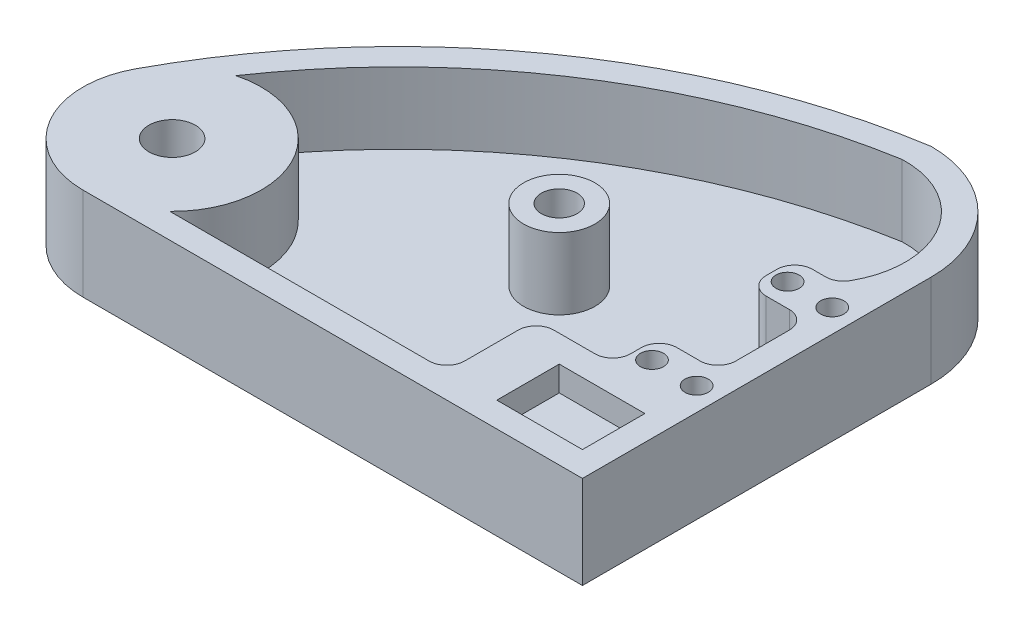
from build123d import *

# Parameters (mm, degrees)
SKETCH1_W           = 24
SKETCH1_H           = 17.5
SKETCH1_R           = 3.249999996
SKETCH1_R_2         = 3.25
SKETCH1_R_3         = 6.5
BOSS_EXTRUDE1_DEPTH = 26
SKETCH1_3_R         = 10
BOSS_EXTRUDE2_DEPTH = 6
SKETCH1_4_W         = 24
SKETCH1_4_H         = 17.5
BOSS_EXTRUDE3_DEPTH = 19
SKETCH1_5_R         = 10
SKETCH1_5_R_2       = 5
BOSS_EXTRUDE4_DEPTH = 26


with BuildPart() as part:
    # Sketch1 → Boss-Extrude1 (new body)
    with BuildSketch(Plane(origin=(0, 0, 0), x_dir=(1, 0, 0), z_dir=(0, 1, 0))):
        with BuildLine():
            ThreePointArc((38.25, 65.967283386), (-37.738740481, 34.900395081), (-92.028760258, -26.679098109))
            ThreePointArc((-92.028760258, -26.679098109), (-91.453700698, -51.335058487), (-70, -63.5))
            Line((-70, -63.5), (70, -63.5))
            Line((70, -63.5), (70, 34.217283386))
            ThreePointArc((70, 34.217283386), (60.700640303, 56.667923689), (38.25, 65.967283386))
        make_face()
        with BuildLine():
            Line((20, -56.5), (-52.650648427, -56.5))
            ThreePointArc((-52.650648427, -56.5), (-48.204829606, -26.253753738), (-76.350661821, -14.320068353))
            ThreePointArc((-76.350661821, -14.320068353), (-26.940104532, 33.755265523), (37.320914143, 58.718486024))
            ThreePointArc((37.320914143, 58.718486024), (59.232009713, 46.90299975), (59.514375282, 22.010790233))
            ThreePointArc((59.514375282, 22.010790233), (57.683425726, 20.172988974), (55.178036419, 19.5))
            Line((55.178036419, 19.5), (51.5, 19.5))
            ThreePointArc((51.5, 19.5), (47.964466094, 18.035533906), (46.5, 14.5))
            Line((46.5, 14.5), (46.5, 11.5))
            ThreePointArc((46.5, 11.5), (47.964466094, 7.964466094), (51.5, 6.5))
            Line((51.5, 6.5), (58, 6.5))
            ThreePointArc((58, 6.5), (61.535533906, 5.035533906), (63, 1.5))
            Line((63, 1.5), (63, -13.5))
            ThreePointArc((63, -13.5), (61.535533906, -17.035533906), (58, -18.5))
            Line((58, -18.5), (51.5, -18.5))
            ThreePointArc((51.5, -18.5), (47.964466094, -19.964466094), (46.5, -23.5))
            Line((46.5, -23.5), (46.5, -26.5))
            ThreePointArc((46.5, -26.5), (45.035533906, -30.035533906), (41.5, -31.5))
            Line((41.5, -31.5), (30, -31.5))
            ThreePointArc((30, -31.5), (26.464466094, -32.964466094), (25, -36.5))
            Line((25, -36.5), (25, -51.5))
            ThreePointArc((25, -51.5), (23.535533906, -55.035533906), (20, -56.5))
        make_face(mode=Mode.SUBTRACT)
        with Locations((51, -47.75)):
            Rectangle(SKETCH1_W, SKETCH1_H, mode=Mode.SUBTRACT)
        with Locations((51, -25)):
            Circle(SKETCH1_R, mode=Mode.SUBTRACT)
        with Locations((63.5, -25)):
            Circle(SKETCH1_R_2, mode=Mode.SUBTRACT)
        with Locations((51, 13)):
            Circle(SKETCH1_R, mode=Mode.SUBTRACT)
        with Locations((63.5, 13)):
            Circle(SKETCH1_R_2, mode=Mode.SUBTRACT)
        with Locations((-70, -38.5)):
            Circle(SKETCH1_R_3, mode=Mode.SUBTRACT)
    extrude(amount=BOSS_EXTRUDE1_DEPTH)

    # Sketch1<3> → Boss-Extrude2 (add)
    with BuildSketch(Plane(origin=(0, 0, 0), x_dir=(1, 0, 0), z_dir=(0, 1, 0))):
        with BuildLine():
            ThreePointArc((-45, -38.5), (-46.992025412, -48.279218033), (-52.650648427, -56.5))
            Line((-52.650648427, -56.5), (20, -56.5))
            ThreePointArc((20, -56.5), (23.535533906, -55.035533906), (25, -51.5))
            Line((25, -51.5), (25, -36.5))
            ThreePointArc((25, -36.5), (26.464466094, -32.964466094), (30, -31.5))
            Line((30, -31.5), (41.5, -31.5))
            ThreePointArc((41.5, -31.5), (45.035533906, -30.035533906), (46.5, -26.5))
            Line((46.5, -26.5), (46.5, -23.5))
            ThreePointArc((46.5, -23.5), (47.964466094, -19.964466094), (51.5, -18.5))
            Line((51.5, -18.5), (58, -18.5))
            ThreePointArc((58, -18.5), (61.535533906, -17.035533906), (63, -13.5))
            Line((63, -13.5), (63, 1.5))
            ThreePointArc((63, 1.5), (61.535533906, 5.035533906), (58, 6.5))
            Line((58, 6.5), (51.5, 6.5))
            ThreePointArc((51.5, 6.5), (47.964466094, 7.964466094), (46.5, 11.5))
            Line((46.5, 11.5), (46.5, 14.5))
            ThreePointArc((46.5, 14.5), (47.964466094, 18.035533906), (51.5, 19.5))
            Line((51.5, 19.5), (55.178036419, 19.5))
            ThreePointArc((55.178036419, 19.5), (57.683425726, 20.172988974), (59.514375282, 22.010790233))
            ThreePointArc((59.514375282, 22.010790233), (59.232009713, 46.90299975), (37.320914143, 58.718486024))
            ThreePointArc((37.320914143, 58.718486024), (-26.940104532, 33.755265523), (-76.350661821, -14.320068353))
            ThreePointArc((-76.350661821, -14.320068353), (-54.731839428, -18.703958154), (-45, -38.5))
        make_face()
        Circle(SKETCH1_3_R, mode=Mode.SUBTRACT)
    extrude(amount=BOSS_EXTRUDE2_DEPTH)

    # Sketch1<4> → Boss-Extrude3 (add)
    with BuildSketch(Plane(origin=(0, 0, 0), x_dir=(1, 0, 0), z_dir=(0, 1, 0))):
        with Locations((51, -47.75)):
            Rectangle(SKETCH1_4_W, SKETCH1_4_H)
    extrude(amount=BOSS_EXTRUDE3_DEPTH)

    # Sketch1<5> → Boss-Extrude4 (add)
    with BuildSketch(Plane(origin=(0, 0, 0), x_dir=(1, 0, 0), z_dir=(0, 1, 0))):
        Circle(SKETCH1_5_R)
        Circle(SKETCH1_5_R_2, mode=Mode.SUBTRACT)
    extrude(amount=BOSS_EXTRUDE4_DEPTH)


solid = part.part
